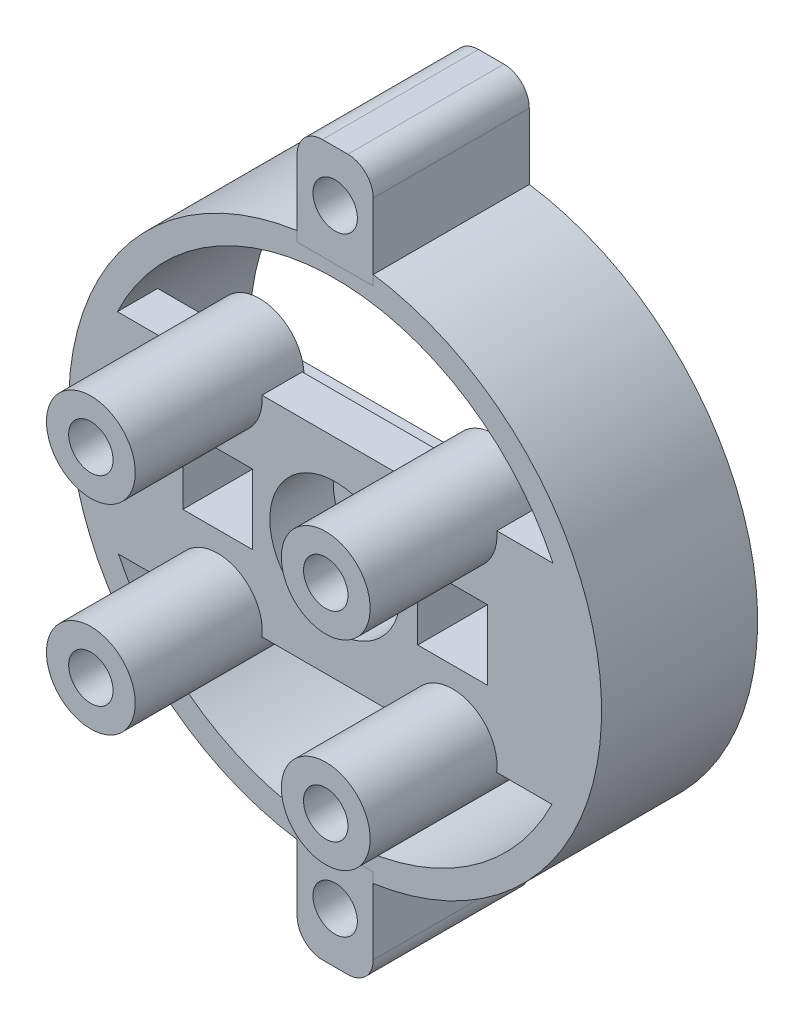
from build123d import *

# Parameters (mm, degrees)
SKETCH1_R               = 21
SKETCH1_R_2             = 19.01
BOSS_EXTRUDE1_DEPTH     = 12.3
BOSS_EXTRUDE3_START     = -3.175
SKETCH4_W               = 16.5
SKETCH4_H               = 16.5
BOSS_EXTRUDE3_DEPTH     = 3.175
SKETCH8_W               = 29.000689647
SKETCH8_H               = 11.495244731
SKETCH8_R               = 2.5875
BOSS_EXTRUDE4_DEPTH     = 3
CUT_EXTRUDE2_DEPTH      = 33.144828511
CUT_EXTRUDE2_DEPTH_BACK = 5
SKETCH7_R               = 5.15
SKETCH11_W              = 5.5
SKETCH11_H              = 5.5
CUT_EXTRUDE21_DEPTH     = 29
BOSS_EXTRUDE5_START     = -12.3
SKETCH12_W              = 6
SKETCH12_H              = 8
SKETCH12_R              = 1.75
BOSS_EXTRUDE5_DEPTH     = 12.3001
FILLET1_R               = 2
BOSS_EXTRUDE6_START     = -3.3
SKETCH13_R              = 3.5
BOSS_EXTRUDE6_DEPTH     = 13.3
SKETCH14_R              = 1.75
CUT_EXTRUDE22_DEPTH     = 20.3
MIRROR7_START           = -3.3
MIRROR7_COPY_1_SKETCH_R = 3.5
MIRROR7_COPY_1_DEPTH    = 13.3
MIRROR7_COPY_2_SKETCH_R = 1.75
MIRROR7_COPY_2_DEPTH    = 20.3


with BuildPart() as part:
    # Sketch1 → Boss-Extrude1 (new body)
    with BuildSketch(Plane.XY):
        Circle(SKETCH1_R)
        Circle(SKETCH1_R_2, mode=Mode.SUBTRACT)
    extrude(amount=BOSS_EXTRUDE1_DEPTH)

    # Sketch4 → Boss-Extrude3 (add)
    with BuildSketch(Plane.XY.offset(12.3).offset(BOSS_EXTRUDE3_START)):
        with BuildLine():
            ThreePointArc((19.01, 0), (18.543691139, 4.184688632), (17.167641352, 8.164079275))
            Line((17.167641352, 8.164079275), (8.267129889, 8.164079275))
            Line((8.267129889, 8.164079275), (8.267129889, -8.335920725))
            Line((8.267129889, -8.335920725), (17.084862471, -8.335920725))
            ThreePointArc((17.084862471, -8.335920725), (18.522463869, -4.277666678), (19.01, 0))
        make_face()
        with Locations((0.017129889, -0.085920725)):
            Rectangle(SKETCH4_W, SKETCH4_H)
        with BuildLine():
            Line((-8.232870111, 8.164079275), (-17.167641352, 8.164079275))
            ThreePointArc((-17.167641352, 8.164079275), (-19.00976077, -0.095370104), (-17.084862471, -8.335920725))
            Line((-17.084862471, -8.335920725), (-8.232870111, -8.335920725))
            Line((-8.232870111, -8.335920725), (-8.232870111, 8.164079275))
        make_face()
    extrude(amount=BOSS_EXTRUDE3_DEPTH)

    # Sketch8 → Boss-Extrude4 (add)
    with BuildSketch(Plane.XY.offset(9.125)):
        with Locations((-0.119782029, 0.187903113)):
            Rectangle(SKETCH8_W, SKETCH8_H)
        with Locations((-0.11978203, 0.187903113)):
            Circle(SKETCH8_R, mode=Mode.SUBTRACT)
    extrude(amount=-BOSS_EXTRUDE4_DEPTH)

    # Sketch7 → Cut-Extrude2 (cut, two sides: drawn at the far end of the back side and taken through both)
    with BuildSketch(Plane.XY.offset(12.3).offset(-CUT_EXTRUDE2_DEPTH_BACK)):
        with Locations(Location((0, 0, 0), (0, 0, 180))):
            Circle(SKETCH7_R)
    extrude(amount=CUT_EXTRUDE2_DEPTH + CUT_EXTRUDE2_DEPTH_BACK, mode=Mode.SUBTRACT)

    # Sketch11 → Cut-Extrude21 (cut)
    with BuildSketch(Plane(origin=(0, 0, 12.3), x_dir=(-1, 0, 0), z_dir=(0, 0, -1))):
        with Locations((-9.257481694, 0)):
            Rectangle(SKETCH11_W, SKETCH11_H)
    cut_extrude21 = extrude(amount=CUT_EXTRUDE21_DEPTH, mode=Mode.SUBTRACT)

    # Mirror1: Cut-Extrude21 across plane
    add(cut_extrude21.mirror(Plane(origin=(0, 0, 0), x_dir=(0, 0, 1), z_dir=(1, 0, 0))), mode=Mode.SUBTRACT)

    # Sketch12 → Boss-Extrude5 (add)
    with BuildSketch(Plane.XY.offset(12.3).offset(BOSS_EXTRUDE5_START)):
        with Locations((0, 24)):
            Rectangle(SKETCH12_W, SKETCH12_H)
        with Locations((0, 24)):
            Circle(SKETCH12_R, mode=Mode.SUBTRACT)
    boss_extrude5 = extrude(amount=BOSS_EXTRUDE5_DEPTH)

    # Mirror3: Boss-Extrude5 across plane
    add(boss_extrude5.mirror(Plane.ZX))

    # Fillet1
    fillet1_edges = [part.edges().sort_by_distance(p)[0] for p in [
        (-3, -28, 6.15005),
        (3, -28, 6.15005),
        (-3, 28, 6.15005),
        (3, 28, 6.15005),
    ]]
    fillet(fillet1_edges, radius=FILLET1_R)

    # Sketch13 → Boss-Extrude6 (add)
    with BuildSketch(Plane.XY.offset(12.3).offset(BOSS_EXTRUDE6_START)):
        with Locations((-9.257481694, -7.871395295)):
            Circle(SKETCH13_R)
    boss_extrude6 = extrude(amount=BOSS_EXTRUDE6_DEPTH)

    # Sketch14 → Cut-Extrude22 (cut)
    with BuildSketch(Plane.XY.offset(22.3)):
        with Locations((-9.257481694, -7.871395295)):
            Circle(SKETCH14_R)
    cut_extrude22 = extrude(amount=-CUT_EXTRUDE22_DEPTH, mode=Mode.SUBTRACT)

    # Mirror5: Boss-Extrude6 across plane
    add(boss_extrude6.mirror(Plane(origin=(0, 0, 0), x_dir=(0, 0, 1), z_dir=(1, 0, 0))))

    # Mirror6: Cut-Extrude22 across plane
    add(cut_extrude22.mirror(Plane(origin=(0, 0, 0), x_dir=(0, 0, 1), z_dir=(1, 0, 0))), mode=Mode.SUBTRACT)

    # Mirror7: Boss-Extrude6, Cut-Extrude22 across plane
    add(boss_extrude6.mirror(Plane.ZX))
    add(cut_extrude22.mirror(Plane.ZX), mode=Mode.SUBTRACT)

    # Mirror7 copy 1 sketch → Mirror7 copy 1 (add)
    with BuildSketch(Plane(origin=(0, 0, 12.3), x_dir=(-1, 0, 0), z_dir=(0, 0, 1)).offset(MIRROR7_START)):
        with Locations((-9.257481694, -7.871395295)):
            Circle(MIRROR7_COPY_1_SKETCH_R)
    extrude(amount=MIRROR7_COPY_1_DEPTH)

    # Mirror7 copy 2 sketch → Mirror7 copy 2 (cut)
    with BuildSketch(Plane(origin=(0, 0, 22.3), x_dir=(-1, 0, 0), z_dir=(0, 0, 1))):
        with Locations((-9.257481694, -7.871395295)):
            Circle(MIRROR7_COPY_2_SKETCH_R)
    extrude(amount=-MIRROR7_COPY_2_DEPTH, mode=Mode.SUBTRACT)


solid = part.part
